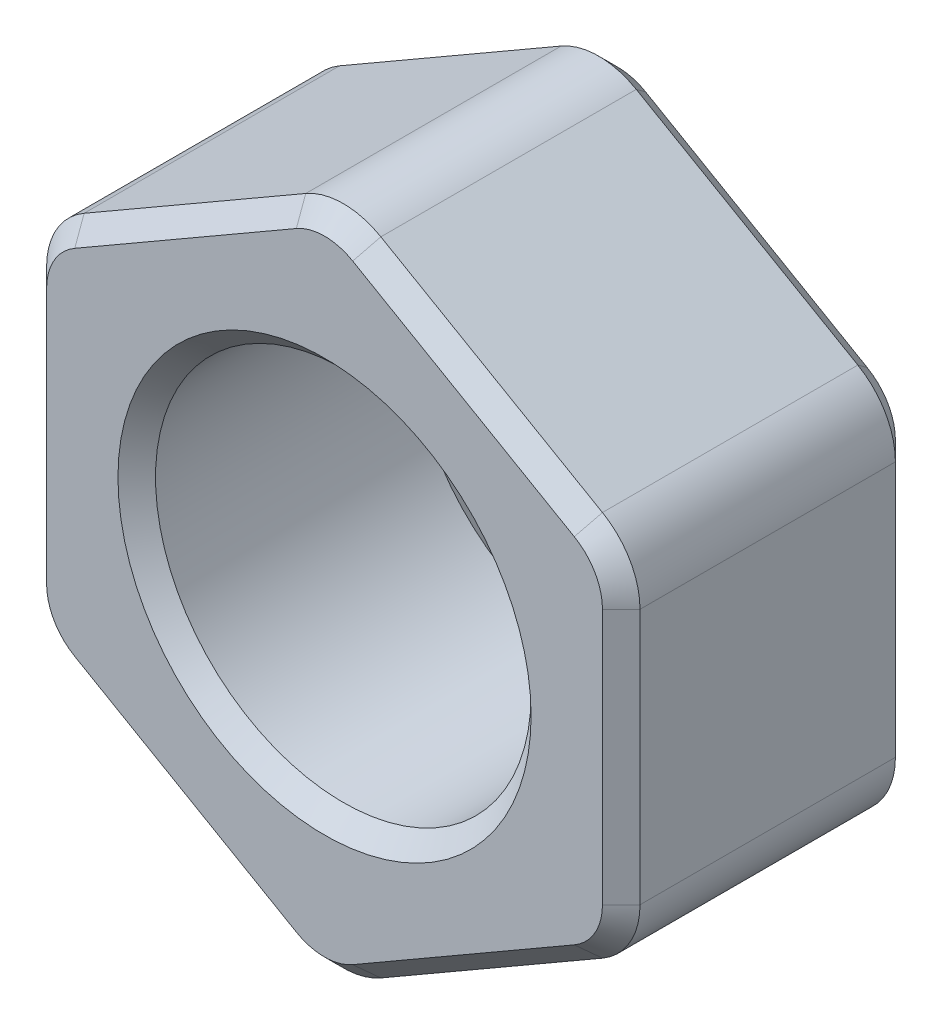
from build123d import *

# Parameters (mm, degrees)
SKIZZE1_R                       = 2.5
AUFSATZ_LINEAR_AUSTRAGEN1_DEPTH = 3.9
VERRUNDUNG1_R                   = 1
FASE1_SIZE                      = 0.25


with BuildPart() as part:
    # Skizze1 → Aufsatz-Linear austragen1 (new body)
    with BuildSketch(Plane.XY):
        Polygon((0, 4.561067127), (3.95, 2.280533563), (3.95, -2.280533563), (0, -4.561067127), (-3.95, -2.280533563), (-3.95, 2.280533563), align=None)
        Circle(SKIZZE1_R, mode=Mode.SUBTRACT)
    extrude(amount=AUFSATZ_LINEAR_AUSTRAGEN1_DEPTH)

    # Verrundung1
    verrundung1_edges = [part.edges().sort_by_distance(p)[0] for p in [
        (0, 4.561067127, 1.95),
        (3.95, 2.280533563, 1.95),
        (3.95, -2.280533563, 1.95),
        (0, -4.561067127, 1.95),
        (-3.95, -2.280533563, 1.95),
        (-3.95, 2.280533563, 1.95),
    ]]
    fillet(verrundung1_edges, radius=VERRUNDUNG1_R)

    # Fase1
    fase1_edges = [part.edges().sort_by_distance(p)[0] for p in [
        (-2.5, 0, 0),
        (-2.5, 0, 3.9),
        (1.975, 3.420800345, 0),
        (1.975, 3.420800345, 3.9),
        (-1.975, 3.420800345, 0),
        (3.95, 0, 0),
        (1.975, -3.420800345, 0),
        (-1.975, -3.420800345, 0),
        (-3.95, 0, 0),
        (0, 4.406366588, 0),
        (-3.816025404, 2.203183294, 0),
        (-3.816025404, -2.203183294, 0),
        (0, -4.406366588, 0),
        (3.816025404, -2.203183294, 0),
        (3.816025404, 2.203183294, 0),
        (3.95, 0, 3.9),
        (-1.975, 3.420800345, 3.9),
        (-3.95, 0, 3.9),
        (-1.975, -3.420800345, 3.9),
        (1.975, -3.420800345, 3.9),
        (0, 4.406366588, 3.9),
        (-3.816025404, 2.203183294, 3.9),
        (-3.816025404, -2.203183294, 3.9),
        (0, -4.406366588, 3.9),
        (3.816025404, -2.203183294, 3.9),
        (3.816025404, 2.203183294, 3.9),
    ]]
    chamfer(fase1_edges, length=FASE1_SIZE)


solid = part.part
